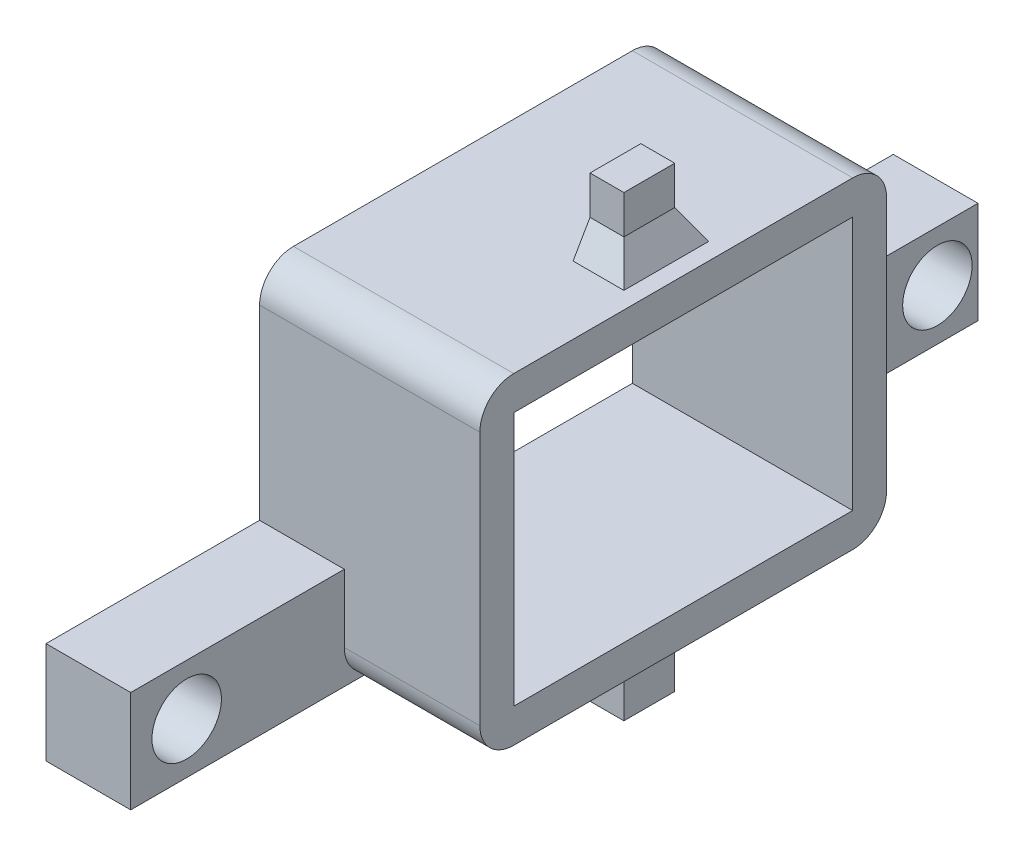
from build123d import *

# Parameters (mm, degrees)
SKETCH1_W           = 24
SKETCH1_H           = 19
SKETCH1_W_2         = 20
SKETCH1_H_2         = 15
BOSS_EXTRUDE1_DEPTH = 13
SKETCH2_W           = 13.396276459
SKETCH2_H           = 6.003539649
SKETCH2_R           = 2.05
SKETCH2_W_2         = 12.603723541
SKETCH2_H_2         = 6
BOSS_EXTRUDE2_DEPTH = 5
SKETCH4_W           = 3
SKETCH4_H           = 20
BOSS_EXTRUDE3_DEPTH = 2
SKETCH5_W           = 2
SKETCH5_H           = 3
BOSS_EXTRUDE4_DEPTH = 4
SKETCH6_W           = 2
SKETCH6_H           = 3
BOSS_EXTRUDE5_DEPTH = 4
CHAMFER1_SIZE       = 1
CHAMFER1_SIZE2      = 1.732050808
FILLET1_R           = 2
CHAMFER2_SIZE       = 1
CHAMFER2_SIZE2      = 1.732050808


with BuildPart() as part:
    # Sketch1 → Boss-Extrude1 (new body)
    with BuildSketch(Plane(origin=(0, 0, 0), x_dir=(0, 0, -1), z_dir=(1, 0, 0))):
        with Locations((10, -7.5)):
            Rectangle(SKETCH1_W, SKETCH1_H)
        with Locations((10, -7.5)):
            Rectangle(SKETCH1_W_2, SKETCH1_H_2, mode=Mode.SUBTRACT)
    extrude(amount=BOSS_EXTRUDE1_DEPTH)

    # Sketch2 → Boss-Extrude2 (add)
    # profile 1 of 2: a face of its own
    with BuildSketch(Plane.ZY):
        with Locations((-28.698138229, -13.998230176)):
            Rectangle(SKETCH2_W, SKETCH2_H)
        with Locations((-33, -13.998230176)):
            Circle(SKETCH2_R, mode=Mode.SUBTRACT)
    # profile 2 of 2: a face of its own
    with BuildSketch(Plane.ZY):
        with Locations((8.301861771, -14)):
            Rectangle(SKETCH2_W_2, SKETCH2_H_2)
        with Locations((11.299999965, -14)):
            Circle(SKETCH2_R, mode=Mode.SUBTRACT)
    extrude(amount=-BOSS_EXTRUDE2_DEPTH)

    # Sketch4 → Boss-Extrude3 (add)
    with BuildSketch(Plane.XZ):
        with Locations((1.5, -10)):
            Rectangle(SKETCH4_W, SKETCH4_H)
    extrude(amount=BOSS_EXTRUDE3_DEPTH)

    # Sketch5 → Boss-Extrude4 (add)
    with BuildSketch(Plane(origin=(0, 2, 0), x_dir=(1, 0, 0), z_dir=(0, 1, 0))):
        with Locations((10, 10)):
            Rectangle(SKETCH5_W, SKETCH5_H)
    extrude(amount=BOSS_EXTRUDE4_DEPTH)

    # Sketch6 → Boss-Extrude5 (add)
    with BuildSketch(Plane.XZ.offset(17)):
        with Locations((10, -10)):
            Rectangle(SKETCH6_W, SKETCH6_H)
    extrude(amount=BOSS_EXTRUDE5_DEPTH)

    # Chamfer1
    chamfer1_edges = [part.edges().sort_by_distance(p)[0] for p in [
        (10, 2, -8.5),
        (11, 2, -10),
        (10, 2, -11.5),
    ]]
    chamfer1_side = [part.faces().sort_by_distance(p)[0] for p in [
        (6.431372549, 2, -10),
    ]]
    chamfer(chamfer1_edges, length=CHAMFER1_SIZE, length2=CHAMFER1_SIZE2, reference=chamfer1_side[0])

    # Fillet1
    fillet1_edges = [part.edges().sort_by_distance(p)[0] for p in [
        (6.5, 2, 2),
        (6.5, 2, -22),
        (9, -17, -22),
        (9, -17, 2),
    ]]
    fillet(fillet1_edges, radius=FILLET1_R)

    # Chamfer2
    chamfer2_edges = [part.edges().sort_by_distance(p)[0] for p in [
        (10, -17, -11.5),
        (11, -17, -10),
        (10, -17, -8.5),
    ]]
    chamfer2_side = [part.faces().sort_by_distance(p)[0] for p in [
        (4.962871287, -17, -10.245220581),
    ]]
    chamfer(chamfer2_edges, length=CHAMFER2_SIZE, length2=CHAMFER2_SIZE2, reference=chamfer2_side[0])


solid = part.part
